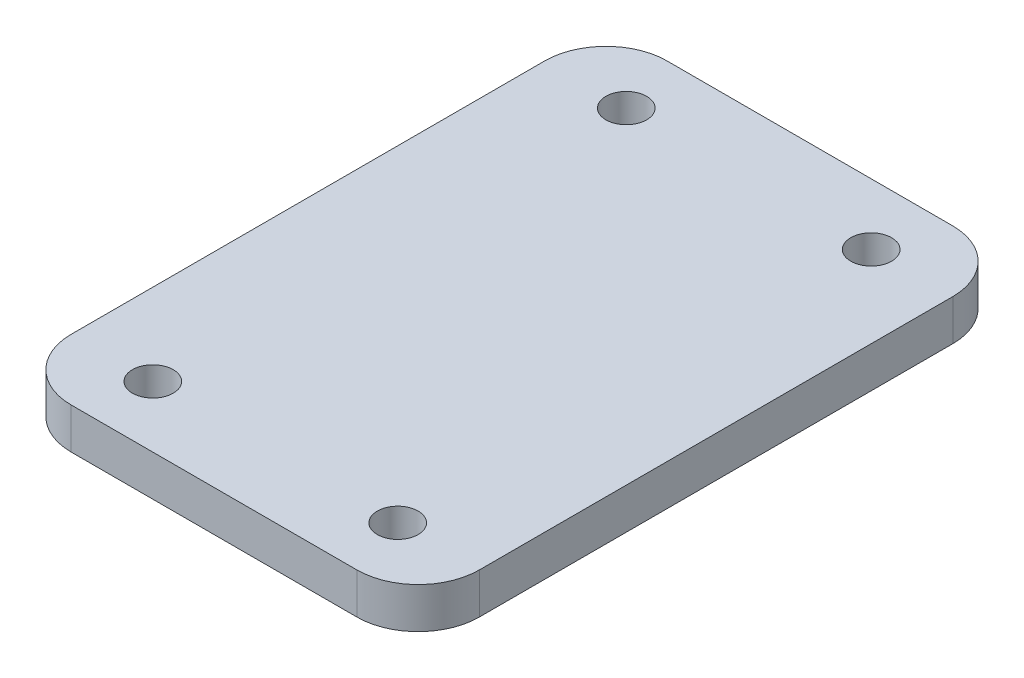
from build123d import *

# Parameters (mm, degrees)
CROQUIS1_W               = 100
CROQUIS1_H               = 146
SALIENTE_EXTRUIR2_DEPTH  = 10
REDONDEO1_R              = 15
CROQUIS2_R               = 5
CORTAR_EXTRUIR1_DEPTH    = 10
MATRIZL1_COUNT           = 2
MATRIZL1_PITCH           = 116
MATRIZL2_COUNT           = 2
MATRIZL2_PITCH           = 60
MATRIZL2_COPY_1_SKETCH_R = 5
MATRIZL2_COPY_1_DEPTH    = 10


with BuildPart() as part:
    # Croquis1 → Saliente-Extruir2 (new body)
    with BuildSketch(Plane(origin=(0, 0, 0), x_dir=(1, 0, 0), z_dir=(0, 1, 0))):
        Rectangle(CROQUIS1_W, CROQUIS1_H)
    extrude(amount=SALIENTE_EXTRUIR2_DEPTH)

    # Redondeo1
    redondeo1_edges = [part.edges().sort_by_distance(p)[0] for p in [
        (-50, 5, -73),
        (50, 5, -73),
        (50, 5, 73),
        (-50, 5, 73),
    ]]
    fillet(redondeo1_edges, radius=REDONDEO1_R)

    # Croquis2 → Cortar-Extruir1 (cut)
    with BuildSketch(Plane(origin=(0, 10, 0), x_dir=(1, 0, 0), z_dir=(0, 1, 0))):
        with Locations(Location((-30, -58, 0), (0, 0, 270))):
            Circle(CROQUIS2_R)
    cortar_extruir1 = extrude(amount=-CORTAR_EXTRUIR1_DEPTH, mode=Mode.SUBTRACT)

    # MatrizL1: Cortar-Extruir1 ×2
    with Locations(*[(0, 0, -i * MATRIZL1_PITCH) for i in range(1, MATRIZL1_COUNT)]):
        add(cortar_extruir1, mode=Mode.SUBTRACT)

    # MatrizL2: Cortar-Extruir1 ×2
    with Locations(*[(i * MATRIZL2_PITCH, 0, 0) for i in range(1, MATRIZL2_COUNT)]):
        add(cortar_extruir1, mode=Mode.SUBTRACT)

    # MatrizL2 copy 1 sketch → MatrizL2 copy 1 (cut)
    with BuildSketch(Plane(origin=(60, 10, -116), x_dir=(1, 0, 0), z_dir=(0, 1, 0))):
        with Locations(Location((-30, -58, 0), (0, 0, 270))):
            Circle(MATRIZL2_COPY_1_SKETCH_R)
    extrude(amount=-MATRIZL2_COPY_1_DEPTH, mode=Mode.SUBTRACT)


solid = part.part
